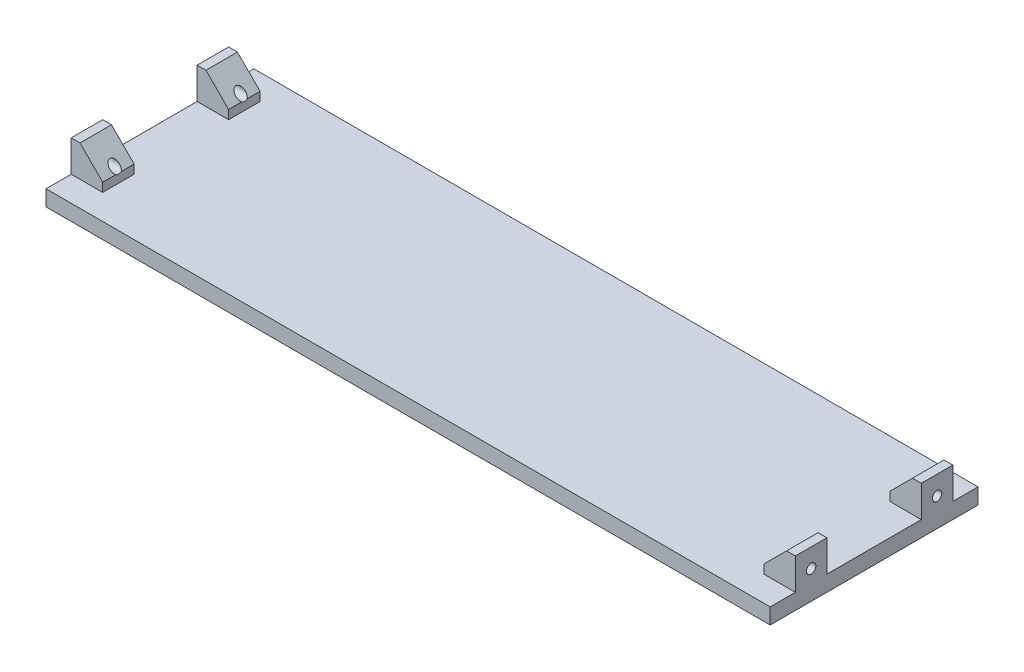
from build123d import *

# Parameters (mm, degrees)
SKETCH1_W           = 230
SKETCH1_H           = 66
BOSS_EXTRUDE1_DEPTH = 5
SKETCH2_W           = 10
SKETCH2_H           = 10
BOSS_EXTRUDE2_DEPTH = 10
SKETCH3_R           = 1.5
CUT_EXTRUDE1_DEPTH  = 233.83900017
CUT_EXTRUDE2_DEPTH  = 238.67414668


with BuildPart() as part:
    # Sketch1 → Boss-Extrude1 (new body)
    with BuildSketch(Plane(origin=(0, 0, 0), x_dir=(1, 0, 0), z_dir=(0, 1, 0))):
        with Locations((115, 0)):
            Rectangle(SKETCH1_W, SKETCH1_H)
    extrude(amount=BOSS_EXTRUDE1_DEPTH)

    # Sketch2 → Boss-Extrude2 (add)
    with BuildSketch(Plane(origin=(0, 5, 0), x_dir=(1, 0, 0), z_dir=(0, 1, 0))):
        with Locations((5, -20)):
            Rectangle(SKETCH2_W, SKETCH2_H)
        with Locations((225, -20)):
            Rectangle(SKETCH2_W, SKETCH2_H)
        with Locations((225, 20)):
            Rectangle(SKETCH2_W, SKETCH2_H)
        with Locations((5, 20)):
            Rectangle(SKETCH2_W, SKETCH2_H)
    extrude(amount=BOSS_EXTRUDE2_DEPTH)

    # Sketch3 → Cut-Extrude1 (cut, through all)
    with BuildSketch(Plane(origin=(230, 0, 0), x_dir=(0, 0, -1), z_dir=(1, 0, 0))):
        with Locations((-20, 9)):
            Circle(SKETCH3_R)
        with Locations((20, 9)):
            Circle(SKETCH3_R)
    extrude(amount=-CUT_EXTRUDE1_DEPTH, mode=Mode.SUBTRACT)

    # Sketch4 → Cut-Extrude2 (cut, through all)
    with BuildSketch(Plane(origin=(0, 0, -25), x_dir=(-1, 0, 0), z_dir=(0, 0, -1))):
        Polygon((-227.2, 15), (-220, 7.8), (-220, 15), align=None)
        Polygon((-2.8, 15), (-10, 15), (-10, 7.8), align=None)
    extrude(amount=-CUT_EXTRUDE2_DEPTH, mode=Mode.SUBTRACT)


solid = part.part
